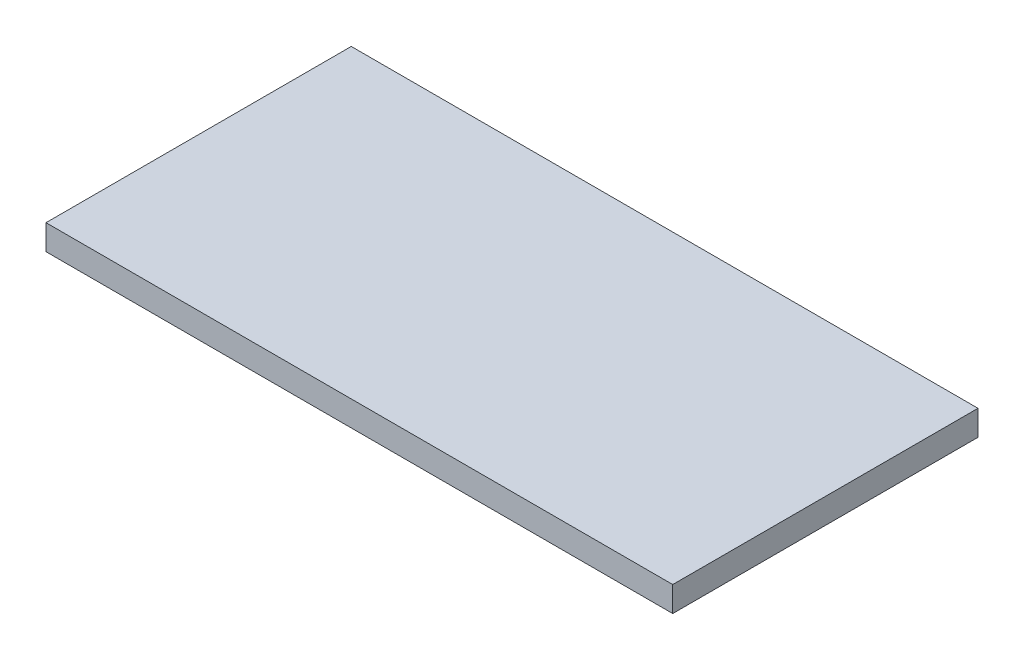
from build123d import *

# Parameters (mm, degrees)
SKETCH1_W           = 249.220426788
SKETCH1_H           = 121.383255676
BOSS_EXTRUDE1_DEPTH = 10


with BuildPart() as part:
    # Sketch1 → Boss-Extrude1 (new body)
    with BuildSketch(Plane(origin=(0, 0, 0), x_dir=(1, 0, 0), z_dir=(0, 1, 0))):
        Rectangle(SKETCH1_W, SKETCH1_H)
    extrude(amount=BOSS_EXTRUDE1_DEPTH)


solid = part.part
